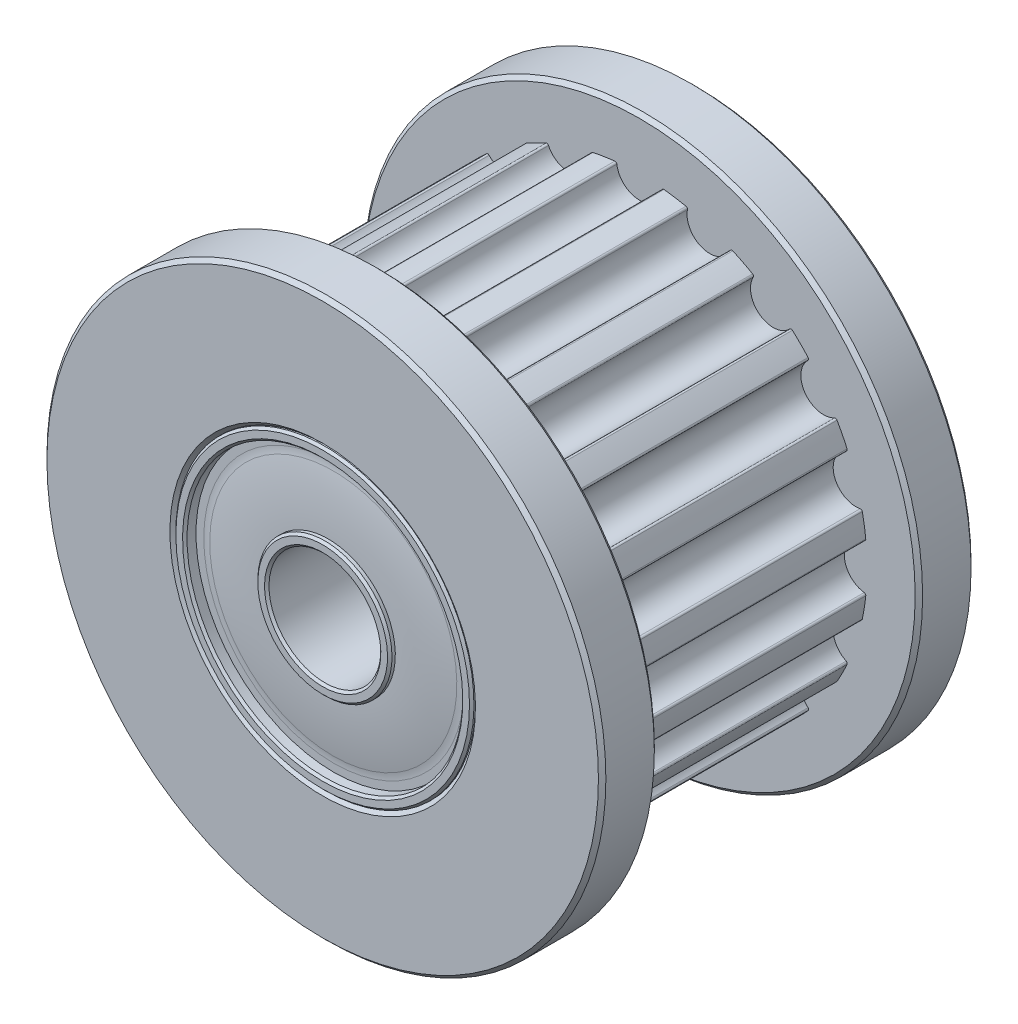
from build123d import *

# Parameters (mm, degrees)
CHAMFER2_SIZE            = 0.06
FILLET2_R                = 1
CHAMFER1_SIZE            = 0.1
CUT_EXTRUDE1_START       = -3.5
CUT_EXTRUDE1_DEPTH       = 7
FILLET1_R                = 0.05
CIRPATTERN3_COUNT        = 20
FILLET1_OF_CIRPATTERN3_R = 0.05


with BuildPart() as part:
    # Sketch2 → Revolve1 (revolve)
    with BuildSketch(Plane(origin=(0, 0, 0), x_dir=(0, 0, -1), z_dir=(1, 0, 0)), mode=Mode.PRIVATE) as revolve1_sk:
        with BuildLine():
            Line((5, 1.5), (2, 1.5))
            Line((2, 1.5), (2, 4))
            Line((2, 4), (5, 4))
            Line((5, 4), (5, 3.7))
            Line((5, 3.7), (4.7, 3.7))
            Line((4.7, 3.7), (4.7, 3.4))
            ThreePointArc((4.7, 3.4), (4.812417963, 2.603507934), (4.85, 1.8))
            Line((4.85, 1.8), (5, 1.8))
            Line((5, 1.8), (5, 1.5))
        make_face()
    revolve(revolve1_sk.sketch.rotate(Axis((0, 0, 5), (0, 0, -1)), 180), axis=Axis((0, 0, 5), (0, 0, -1)))

    # Chamfer2
    chamfer2_edges = [part.edges().sort_by_distance(p)[0] for p in [
        (0, 1.5, -5),
        (0, 1.8, -5),
        (0, 3.7, -5),
        (0, 4, -5),
    ]]
    chamfer(chamfer2_edges, length=CHAMFER2_SIZE)

    # Fillet2
    fillet2_edges = [part.edges().sort_by_distance(p)[0] for p in [
        (0, 3.4, -4.7),
    ]]
    fillet(fillet2_edges, radius=FILLET2_R)


with BuildPart() as body_2:
    # Mirror1: mirrored copy
    add(part.part.mirror(Plane.XY))


with BuildPart() as body_3:
    # Sketch3 → Revolve2 (revolve)
    with BuildSketch(Plane(origin=(0, 0, 0), x_dir=(0, 0, -1), z_dir=(1, 0, 0)), mode=Mode.PRIVATE) as revolve2_sk:
        Polygon((3.5, 7.5), (5, 7.5), (5, 4), (2, 4), (2, 2.5), (-2, 2.5), (-2, 4), (-5, 4), (-5, 7.5), (-3.5, 7.5), (-3.5, 6.11), (3.5, 6.11), align=None)
    revolve(revolve2_sk.sketch.rotate(Axis((0, 0, 5), (0, 0, -1)), 180), axis=Axis((0, 0, 5), (0, 0, -1)))

    # Chamfer1
    chamfer1_edges = [body_3.edges().sort_by_distance(p)[0] for p in [
        (0, 4, 5),
        (0, 4, -5),
        (0, 7.5, -5),
        (0, 7.5, -3.5),
        (0, 7.5, 3.5),
        (0, 7.5, 5),
    ]]
    chamfer(chamfer1_edges, length=CHAMFER1_SIZE)

    # Sketch4 → Cut-Extrude1 (cut)
    with BuildSketch(Plane.XY.offset(CUT_EXTRUDE1_START)):
        with BuildLine():
            Line((-0.611, 6.11), (0.611, 6.11))
            ThreePointArc((0.611, 6.11), (0, 5.499), (-0.611, 6.11))
        make_face()
    cut_extrude1 = extrude(amount=CUT_EXTRUDE1_DEPTH, mode=Mode.SUBTRACT)

    # Fillet1
    fillet1_edges = [body_3.edges().sort_by_distance(p)[0] for p in [
        (0.610235772, 6.07945, 0),
        (-0.610235772, 6.07945, 0),
    ]]
    fillet(fillet1_edges, radius=FILLET1_R)

    # CirPattern3: Cut-Extrude1 ×20 about axis
    cirpattern3_axis = Axis((0, 0, 0), (0, 0, 1))
    for i in range(1, CIRPATTERN3_COUNT):
        add(cut_extrude1.rotate(cirpattern3_axis, i * 360 / CIRPATTERN3_COUNT), mode=Mode.SUBTRACT)

    # Fillet1 of CirPattern3
    fillet1_of_cirpattern3_edges = [body_3.edges().sort_by_distance(p)[0] for p in [
        (-1.298284659, 5.970473762, 0),
        (-2.459022074, 5.593327314, 0),
        (-3.079719942, 5.277065954, 0),
        (-4.067102162, 4.559690779, 0),
        (-4.559690779, 4.067102162, 0),
        (-5.277065954, 3.079719942, 0),
        (-5.593327314, 2.459022074, 0),
        (-5.970473762, 1.298284659, 0),
        (-6.07945, 0.610235772, 0),
        (-6.07945, -0.610235772, 0),
        (-5.970473762, -1.298284659, 0),
        (-5.593327314, -2.459022074, 0),
        (-5.277065954, -3.079719942, 0),
        (-4.559690779, -4.067102162, 0),
        (-4.067102162, -4.559690779, 0),
        (-3.079719942, -5.277065954, 0),
        (-2.459022074, -5.593327314, 0),
        (-1.298284659, -5.970473762, 0),
        (-0.610235772, -6.07945, 0),
        (0.610235772, -6.07945, 0),
        (1.298284659, -5.970473762, 0),
        (2.459022074, -5.593327314, 0),
        (3.079719942, -5.277065954, 0),
        (4.067102162, -4.559690779, 0),
        (4.559690779, -4.067102162, 0),
        (5.277065954, -3.079719942, 0),
        (5.593327314, -2.459022074, 0),
        (5.970473762, -1.298284659, 0),
        (6.07945, -0.610235772, 0),
        (6.07945, 0.610235772, 0),
        (5.970473762, 1.298284659, 0),
        (5.593327314, 2.459022074, 0),
        (5.277065954, 3.079719942, 0),
        (4.559690779, 4.067102162, 0),
        (4.067102162, 4.559690779, 0),
        (3.079719942, 5.277065954, 0),
        (2.459022074, 5.593327314, 0),
        (1.298284659, 5.970473762, 0),
    ]]
    fillet(fillet1_of_cirpattern3_edges, radius=FILLET1_OF_CIRPATTERN3_R)


solid = Compound([part.part, body_2.part, body_3.part])
